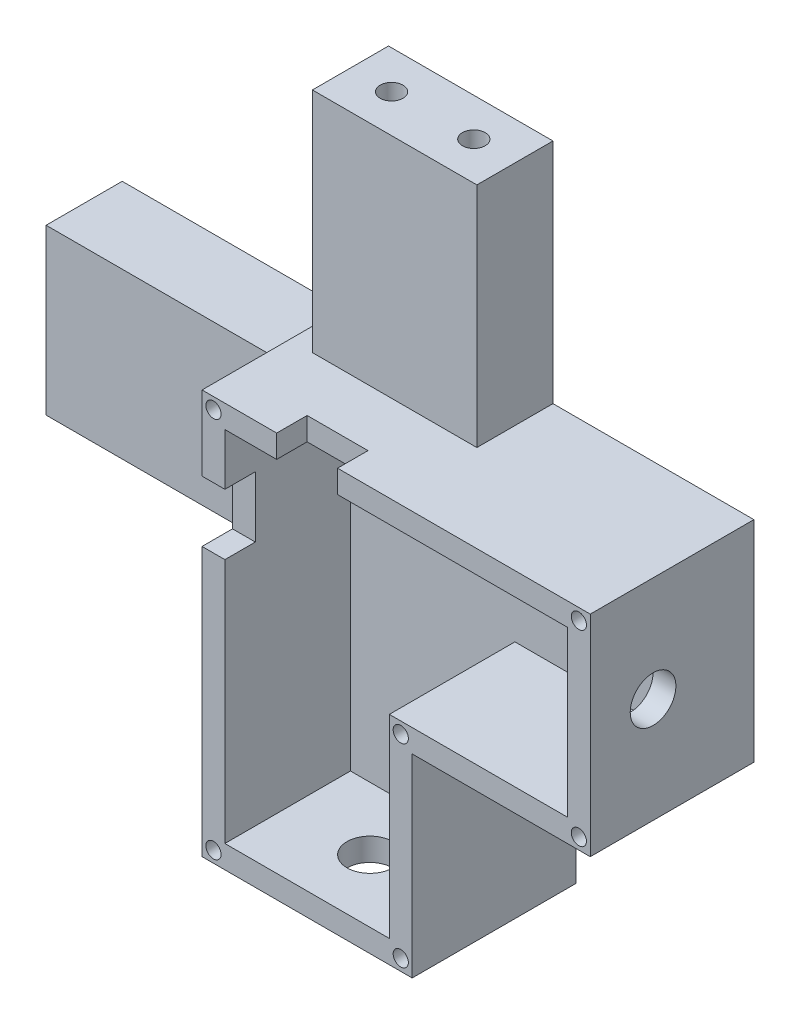
from build123d import *

# Parameters (mm, degrees)
ESQUISSE1_W              = 31.99
ESQUISSE1_H              = 21.61
ESQUISSE1_W_2            = 3
ESQUISSE1_H_2            = 3
ESQUISSE1_W_3            = 21.61
ESQUISSE1_H_3            = 29.89
ESQUISSE1_H_4            = 25.5
BOSS_EXTRU_1_DEPTH       = 26.5
ESQUISSE2_W              = 21.61
ESQUISSE2_H              = 25.5
ESQUISSE2_W_2            = 45.01
ESQUISSE2_H_2            = 21.61
ENL_V_MAT_EXTRU_1_DEPTH  = 21.5
ESQUISSE3_W              = 52.98097293
ESQUISSE3_H              = 57.792843893
ENL_V_MAT_EXTRU_2_DEPTH  = 5
ENL_V_MAT_EXTRU_3_DEPTH  = 5
ESQUISSE5_W              = 31.99
ESQUISSE5_H              = 21.61
ESQUISSE5_W_2            = 21.61
ESQUISSE5_H_2            = 29.89
ENL_V_MAT_EXTRU_4_DEPTH  = 16.5
ENL_V_MAT_EXTRU_5_DEPTH  = 16.5
ENL_V_MAT_EXTRU_6_DEPTH  = 16.5
ESQUISSE8_W              = 4
ESQUISSE8_H              = 4
ENL_V_MAT_EXTRU_7_DEPTH  = 16.5
ESQUISSE9_W              = 4
ESQUISSE9_H              = 4
ENL_V_MAT_EXTRU_8_DEPTH  = 16.5
ENL_V_MAT_EXTRU_9_DEPTH  = 5
ENL_V_MAT_EXTRU_10_DEPTH = 5


with BuildPart() as part:
    # Esquisse1 → Boss.-Extru.1 (new body)
    with BuildSketch(Plane.XY):
        with Locations((-64.005, 10.805)):
            Rectangle(ESQUISSE1_W, ESQUISSE1_H)
        Polygon((-23.4, 0), (0, 0), (0, 21.61), (-23.4, 21.61), (-45.01, 21.61), (-48.01, 21.61), (-48.01, 0), (-45.01, 0), align=None)
        with Locations((-46.51, 23.11)):
            Rectangle(ESQUISSE1_W_2, ESQUISSE1_H_2)
        with Locations((-34.205, 23.11)):
            Rectangle(ESQUISSE1_W_3, ESQUISSE1_H_2)
        with Locations((-34.205, 39.555)):
            Rectangle(ESQUISSE1_W_3, ESQUISSE1_H_3)
        Polygon((0, 21.61), (0, 0), (-23.4, 0), (-23.4, -25.5), (-45.01, -25.5), (-45.01, 0), (-48.01, 0), (-48.01, -28.5), (-20.4, -28.5), (-20.4, -3), (3, -3), (3, 24.61), (-23.4, 24.61), (-23.4, 21.61), align=None)
        with Locations((-34.205, -12.75)):
            Rectangle(ESQUISSE1_W_3, ESQUISSE1_H_4)
    extrude(amount=BOSS_EXTRU_1_DEPTH)

    # Esquisse2 → Enlèv. mat.-Extru.1 (cut)
    with BuildSketch(Plane.XY.offset(26.5)):
        with Locations((-34.205, -12.75)):
            Rectangle(ESQUISSE2_W, ESQUISSE2_H)
        with Locations((-22.505, 10.805)):
            Rectangle(ESQUISSE2_W_2, ESQUISSE2_H_2)
    extrude(amount=-ENL_V_MAT_EXTRU_1_DEPTH, mode=Mode.SUBTRACT)

    # Esquisse3 → Enlèv. mat.-Extru.2 (cut)
    with BuildSketch(Plane.XY.offset(26.5)):
        with Locations((-21.519513535, -4.286421947)):
            Rectangle(ESQUISSE3_W, ESQUISSE3_H)
    extrude(amount=-ENL_V_MAT_EXTRU_2_DEPTH, mode=Mode.SUBTRACT)

    # Esquisse4 → Enlèv. mat.-Extru.3 (cut)
    with BuildSketch(Plane.XY.offset(21.5)):
        with BuildLine():
            ThreePointArc((-20.9, -27), (-21.517316568, -26.076120467), (-22.607106781, -26.292893219))
            Line((-22.607106781, -26.292893219), (-21.192893219, -27.707106781))
            ThreePointArc((-21.192893219, -27.707106781), (-20.976120467, -27.382683432), (-20.9, -27))
        make_face()
        with BuildLine():
            Line((-21.192893219, -27.707106781), (-22.607106781, -26.292893219))
            ThreePointArc((-22.607106781, -26.292893219), (-22.607106781, -27.707106781), (-21.192893219, -27.707106781))
        make_face()
        with BuildLine():
            ThreePointArc((-45.51, -27), (-45.586120467, -26.617316568), (-45.802893219, -26.292893219))
            Line((-45.802893219, -26.292893219), (-47.217106781, -27.707106781))
            ThreePointArc((-47.217106781, -27.707106781), (-46.127316568, -27.923879533), (-45.51, -27))
        make_face()
        with BuildLine():
            Line((-47.217106781, -27.707106781), (-45.802893219, -26.292893219))
            ThreePointArc((-45.802893219, -26.292893219), (-47.217106781, -26.292893219), (-47.217106781, -27.707106781))
        make_face()
        with BuildLine():
            ThreePointArc((-45.51, 23.11), (-46.127316568, 24.033879533), (-47.217106781, 23.817106781))
            Line((-47.217106781, 23.817106781), (-45.802893219, 22.402893219))
            ThreePointArc((-45.802893219, 22.402893219), (-45.586120467, 22.727316568), (-45.51, 23.11))
        make_face()
        with BuildLine():
            Line((-45.802893219, 22.402893219), (-47.217106781, 23.817106781))
            ThreePointArc((-47.217106781, 23.817106781), (-47.217106781, 22.402893219), (-45.802893219, 22.402893219))
        make_face()
        with BuildLine():
            ThreePointArc((2.5, 23.11), (2.423879533, 23.492683432), (2.207106781, 23.817106781))
            Line((2.207106781, 23.817106781), (0.792893219, 22.402893219))
            ThreePointArc((0.792893219, 22.402893219), (1.882683432, 22.186120467), (2.5, 23.11))
        make_face()
        with BuildLine():
            Line((0.792893219, 22.402893219), (2.207106781, 23.817106781))
            ThreePointArc((2.207106781, 23.817106781), (0.792893219, 23.817106781), (0.792893219, 22.402893219))
        make_face()
        with BuildLine():
            ThreePointArc((0.792893219, -0.792893219), (0.792893219, -2.207106781), (2.207106781, -2.207106781))
            Line((2.207106781, -2.207106781), (0.792893219, -0.792893219))
        make_face()
        with BuildLine():
            Line((0.792893219, -0.792893219), (2.207106781, -2.207106781))
            ThreePointArc((2.207106781, -2.207106781), (2.423879533, -1.882683432), (2.5, -1.5))
            ThreePointArc((2.5, -1.5), (1.882683432, -0.576120467), (0.792893219, -0.792893219))
        make_face()
        with BuildLine():
            ThreePointArc((-20.9, -1.5), (-21.517316568, -0.576120467), (-22.607106781, -0.792893219))
            Line((-22.607106781, -0.792893219), (-21.192893219, -2.207106781))
            ThreePointArc((-21.192893219, -2.207106781), (-20.976120467, -1.882683432), (-20.9, -1.5))
        make_face()
        with BuildLine():
            Line((-21.192893219, -2.207106781), (-22.607106781, -0.792893219))
            ThreePointArc((-22.607106781, -0.792893219), (-22.607106781, -2.207106781), (-21.192893219, -2.207106781))
        make_face()
    extrude(amount=-ENL_V_MAT_EXTRU_3_DEPTH, mode=Mode.SUBTRACT)

    # Esquisse5 → Enlèv. mat.-Extru.4 (cut)
    with BuildSketch(Plane.XY.offset(26.5)):
        with Locations((-64.005, 10.805)):
            Rectangle(ESQUISSE5_W, ESQUISSE5_H)
        with Locations((-34.205, 39.555)):
            Rectangle(ESQUISSE5_W_2, ESQUISSE5_H_2)
    extrude(amount=-ENL_V_MAT_EXTRU_4_DEPTH, mode=Mode.SUBTRACT)

    # Esquisse6 → Enlèv. mat.-Extru.5 (cut)
    with BuildSketch(Plane.ZY):
        with BuildLine():
            ThreePointArc((16.25, 10.805), (14.580081534, 13.494030144), (11.429411258, 13.189419559))
            Line((11.429411258, 13.189419559), (15.070588742, 8.420580441))
            ThreePointArc((15.070588742, 8.420580441), (15.939030144, 9.474918466), (16.25, 10.805))
        make_face()
        with BuildLine():
            Line((15.070588742, 8.420580441), (11.429411258, 13.189419559))
            ThreePointArc((11.429411258, 13.189419559), (10.865580441, 8.984411258), (15.070588742, 8.420580441))
        make_face()
    extrude(amount=-ENL_V_MAT_EXTRU_5_DEPTH, mode=Mode.SUBTRACT)

    # Esquisse7 → Enlèv. mat.-Extru.6 (cut)
    with BuildSketch(Plane(origin=(0, -25.5, 0), x_dir=(1, 0, 0), z_dir=(0, 1, 0))):
        with BuildLine():
            ThreePointArc((-31.205, -13.25), (-33.244078223, -10.408058879), (-36.589419559, -11.429411258))
            Line((-36.589419559, -11.429411258), (-31.820580441, -15.070588742))
            ThreePointArc((-31.820580441, -15.070588742), (-31.363058879, -14.210921777), (-31.205, -13.25))
        make_face()
        with BuildLine():
            Line((-31.820580441, -15.070588742), (-36.589419559, -11.429411258))
            ThreePointArc((-36.589419559, -11.429411258), (-36.025588742, -15.634419559), (-31.820580441, -15.070588742))
        make_face()
    extrude(amount=-ENL_V_MAT_EXTRU_6_DEPTH, mode=Mode.SUBTRACT)

    # Esquisse8 → Enlèv. mat.-Extru.7 (cut)
    with BuildSketch(Plane(origin=(0, 24.61, 0), x_dir=(1, 0, 0), z_dir=(0, 1, 0))):
        with Locations((-32.205, -19.5)):
            Rectangle(ESQUISSE8_W, ESQUISSE8_H)
        with Locations((-36.205, -19.5)):
            Rectangle(ESQUISSE8_W, ESQUISSE8_H)
    extrude(amount=-ENL_V_MAT_EXTRU_7_DEPTH, mode=Mode.SUBTRACT)

    # Esquisse9 → Enlèv. mat.-Extru.8 (cut)
    with BuildSketch(Plane.ZY.offset(48.01)):
        with Locations((19.5, 8.805)):
            Rectangle(ESQUISSE9_W, ESQUISSE9_H)
        with Locations((19.5, 12.805)):
            Rectangle(ESQUISSE9_W, ESQUISSE9_H)
    extrude(amount=-ENL_V_MAT_EXTRU_8_DEPTH, mode=Mode.SUBTRACT)

    # Esquisse10 → Enlèv. mat.-Extru.9 (cut)
    with BuildSketch(Plane.ZY.offset(80)):
        with BuildLine():
            ThreePointArc((6.5, 16.2075), (6.374461183, 16.80821329), (6.018858058, 17.308376132))
            Line((6.018858058, 17.308376132), (3.981141942, 15.106623868))
            ThreePointArc((3.981141942, 15.106623868), (5.60071329, 14.833038817), (6.5, 16.2075))
        make_face()
        with BuildLine():
            Line((3.981141942, 15.106623868), (6.018858058, 17.308376132))
            ThreePointArc((6.018858058, 17.308376132), (3.899123868, 17.226358058), (3.981141942, 15.106623868))
        make_face()
        with BuildLine():
            ThreePointArc((6.5, 5.4025), (5.60071329, 6.776961183), (3.981141942, 6.503376132))
            Line((3.981141942, 6.503376132), (6.018858058, 4.301623868))
            ThreePointArc((6.018858058, 4.301623868), (6.374461183, 4.80178671), (6.5, 5.4025))
        make_face()
        with BuildLine():
            Line((6.018858058, 4.301623868), (3.981141942, 6.503376132))
            ThreePointArc((3.981141942, 6.503376132), (3.899123868, 4.383641942), (6.018858058, 4.301623868))
        make_face()
    extrude(amount=-ENL_V_MAT_EXTRU_9_DEPTH, mode=Mode.SUBTRACT)

    # Esquisse11 → Enlèv. mat.-Extru.10 (cut)
    with BuildSketch(Plane(origin=(0, 54.5, 0), x_dir=(1, 0, 0), z_dir=(0, 1, 0))):
        with BuildLine():
            ThreePointArc((-29.903376132, -3.981141942), (-29.821358058, -6.100876132), (-27.701623868, -6.018858058))
            Line((-27.701623868, -6.018858058), (-29.903376132, -3.981141942))
        make_face()
        with BuildLine():
            Line((-29.903376132, -3.981141942), (-27.701623868, -6.018858058))
            ThreePointArc((-27.701623868, -6.018858058), (-27.405840736, -5.547122382), (-27.3025, -5))
            ThreePointArc((-27.3025, -5), (-28.255377618, -3.603340736), (-29.903376132, -3.981141942))
        make_face()
        with BuildLine():
            ThreePointArc((-38.1075, -5), (-38.210840736, -4.452877618), (-38.506623868, -3.981141942))
            Line((-38.506623868, -3.981141942), (-40.708376132, -6.018858058))
            ThreePointArc((-40.708376132, -6.018858058), (-39.060377618, -6.396659264), (-38.1075, -5))
        make_face()
        with BuildLine():
            Line((-40.708376132, -6.018858058), (-38.506623868, -3.981141942))
            ThreePointArc((-38.506623868, -3.981141942), (-40.626358058, -3.899123868), (-40.708376132, -6.018858058))
        make_face()
    extrude(amount=-ENL_V_MAT_EXTRU_10_DEPTH, mode=Mode.SUBTRACT)


solid = part.part
